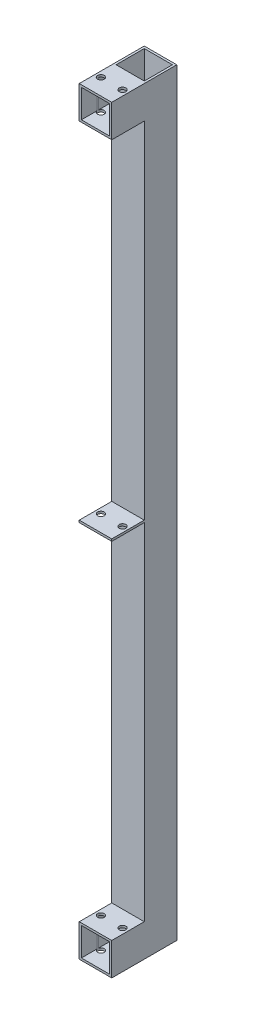
from build123d import *

# Parameters (mm, degrees)
ESQUISSE1_W                = 30
ESQUISSE1_H                = 700
BOSS_EXTRU_1_DEPTH         = 30
ESQUISSE2_W                = 30
ESQUISSE2_H                = 30
ESQUISSE2_H_2              = 2
BOSS_EXTRU_2_DEPTH         = 30
ESQUISSE3_W                = 26
ESQUISSE3_H                = 26
ENL_V_MAT_EXTRU_1_DEPTH    = 30
R_P_TITION_LIN_AIRE2_COUNT = 3
R_P_TITION_LIN_AIRE2_PITCH = 670
ESQUISSE4_W                = 26
ESQUISSE4_H                = 26
ENL_V_MAT_EXTRU_2_DEPTH    = 703.726831706
ESQUISSE5_R                = 3.05
ENL_V_MAT_EXTRU_3_DEPTH    = 703.726831706
ESQUISSE7_R                = 7.05
ENL_V_MAT_EXTRU_4_DEPTH    = 28


with BuildPart() as part:
    # Esquisse1 → Boss.-Extru.1 (new body)
    with BuildSketch(Plane.XY):
        Rectangle(ESQUISSE1_W, ESQUISSE1_H)
    extrude(amount=BOSS_EXTRU_1_DEPTH)

    # Esquisse2 → Boss.-Extru.2 (add)
    with BuildSketch(Plane.XY.offset(30)):
        with Locations((0, 335)):
            Rectangle(ESQUISSE2_W, ESQUISSE2_H)
        with Locations((0, -335)):
            Rectangle(ESQUISSE2_W, ESQUISSE2_H)
        Rectangle(ESQUISSE2_W, ESQUISSE2_H_2)
    extrude(amount=BOSS_EXTRU_2_DEPTH)

    # Esquisse3 → Enlèv. mat.-Extru.1 (cut)
    with BuildSketch(Plane.XY.offset(60)):
        with Locations((0, 335)):
            Rectangle(ESQUISSE3_W, ESQUISSE3_H)
    enl_v_mat_extru_1 = extrude(amount=-ENL_V_MAT_EXTRU_1_DEPTH, mode=Mode.SUBTRACT)

    # Répétition linéaire2: Enlèv. mat.-Extru.1 ×3
    with Locations(*[(0, -i * R_P_TITION_LIN_AIRE2_PITCH, 0) for i in range(1, R_P_TITION_LIN_AIRE2_COUNT)]):
        add(enl_v_mat_extru_1, mode=Mode.SUBTRACT)

    # Esquisse4 → Enlèv. mat.-Extru.2 (cut, through all)
    with BuildSketch(Plane(origin=(0, -350, 0), x_dir=(-1, 0, 0), z_dir=(0, -1, 0))):
        with Locations((0, -15)):
            Rectangle(ESQUISSE4_W, ESQUISSE4_H)
    extrude(amount=-ENL_V_MAT_EXTRU_2_DEPTH, mode=Mode.SUBTRACT)

    # Esquisse5 → Enlèv. mat.-Extru.3 (cut, through all)
    with BuildSketch(Plane(origin=(0, -350, 0), x_dir=(-1, 0, 0), z_dir=(0, -1, 0))):
        with Locations(Location((10, -45, 0), (0, 0, 90))):
            Circle(ESQUISSE5_R)
        with Locations(Location((-10, -45, 0), (0, 0, 90))):
            Circle(ESQUISSE5_R)
    extrude(amount=-ENL_V_MAT_EXTRU_3_DEPTH, mode=Mode.SUBTRACT)

    # Esquisse7 → Enlèv. mat.-Extru.4 (cut)
    with BuildSketch(Plane(origin=(0, 0, 0), x_dir=(-1, 0, 0), z_dir=(0, 0, -1))):
        Circle(ESQUISSE7_R)
    extrude(amount=-ENL_V_MAT_EXTRU_4_DEPTH, mode=Mode.SUBTRACT)


solid = part.part
